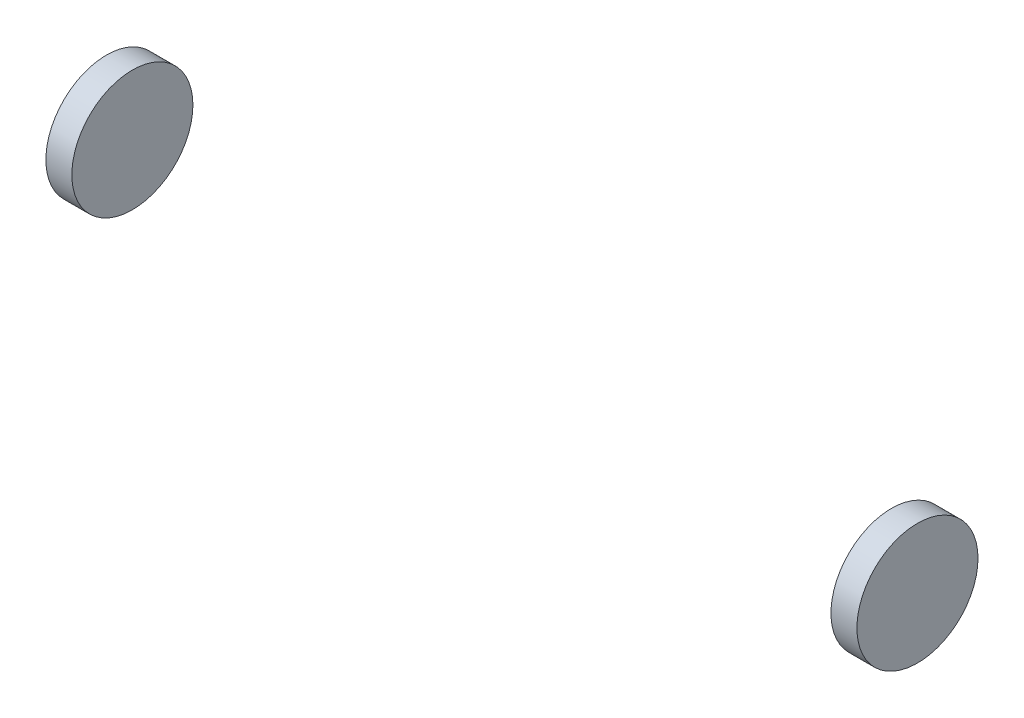
from build123d import *

# Parameters (mm, degrees)
BOSS_EXTRUDE1_START = -937.712701274
SKETCH1_R           = 140
BOSS_EXTRUDE1_DEPTH = 60
BOSS_EXTRUDE2_START = 877.712701274
SKETCH2_R           = 140
BOSS_EXTRUDE2_DEPTH = 60


with BuildPart() as part:
    # Sketch1 → Boss-Extrude1 (new body)
    with BuildSketch(Plane(origin=(0, 0, 0), x_dir=(0, 0, -1), z_dir=(1, 0, 0)).offset(BOSS_EXTRUDE1_START)):
        Circle(SKETCH1_R)
    extrude(amount=BOSS_EXTRUDE1_DEPTH)


with BuildPart() as body_2:
    # Sketch2 → Boss-Extrude2 (new body)
    with BuildSketch(Plane(origin=(0, 0, 0), x_dir=(0, 0, -1), z_dir=(1, 0, 0)).offset(BOSS_EXTRUDE2_START)):
        Circle(SKETCH2_R)
    extrude(amount=BOSS_EXTRUDE2_DEPTH)


solid = Compound([part.part, body_2.part])
